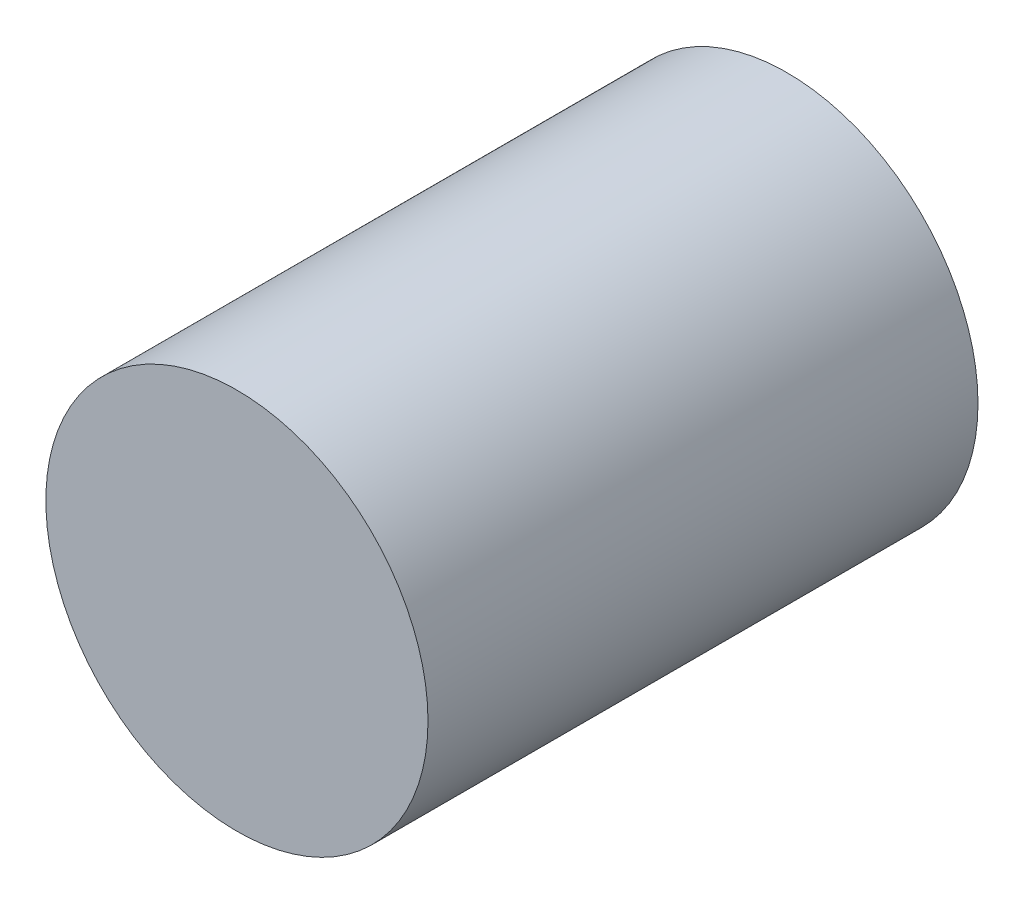
from build123d import *

# Parameters (mm, degrees)
SKETCH_1_R      = 7.29565053
EXTRUDE_1_DEPTH = 21


with BuildPart() as part:
    # 草图1 → 凸台-拉伸1 (new body)
    with BuildSketch(Plane.XY):
        with Locations((-41.009085146, 15.240542187)):
            Circle(SKETCH_1_R)
    extrude(amount=EXTRUDE_1_DEPTH)


solid = part.part
